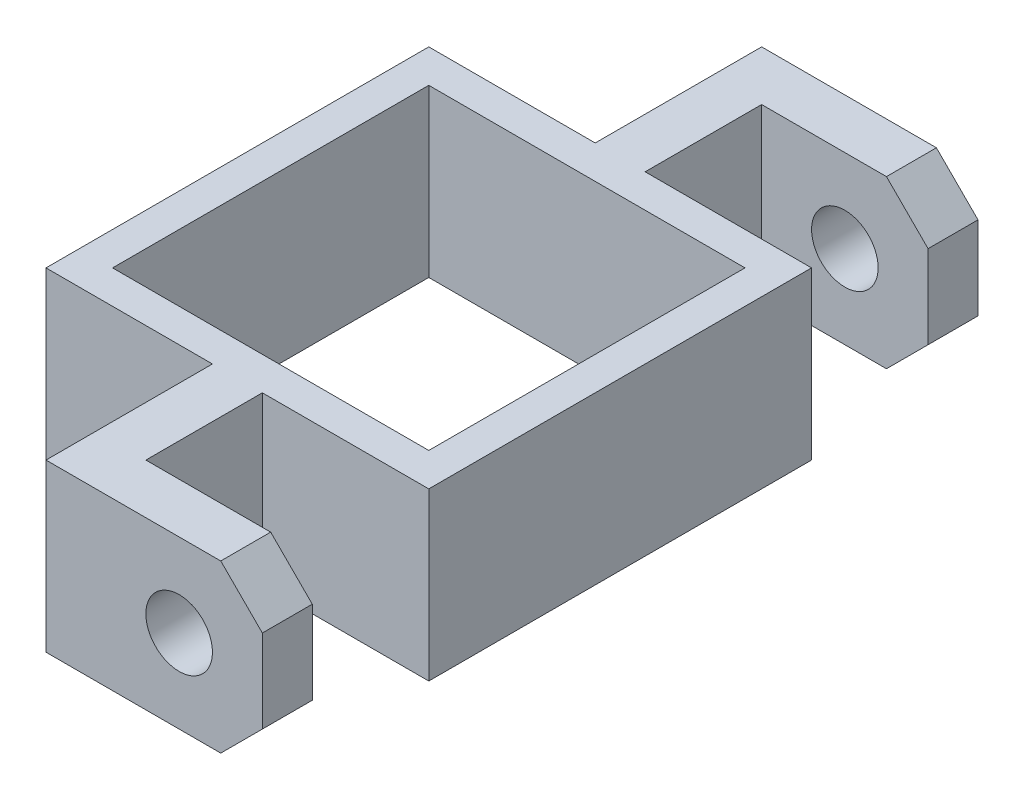
from build123d import *

# Parameters (mm, degrees)
CROQUIS1_W              = 23
CROQUIS1_H              = 23
CROQUIS1_W_2            = 19
CROQUIS1_H_2            = 19
SALIENTE_EXTRUIR1_DEPTH = 10
CROQUIS2_W              = 7
CROQUIS2_H              = 10
SALIENTE_EXTRUIR2_DEPTH = 1.5
SALIENTE_EXTRUIR3_DEPTH = 3
CROQUIS4_R              = 2
CORTAR_EXTRUIR1_DEPTH   = 4


with BuildPart() as part:
    # Croquis1 → Saliente-Extruir1 (new body)
    with BuildSketch(Plane(origin=(0, 0, 0), x_dir=(1, 0, 0), z_dir=(0, 1, 0))):
        Rectangle(CROQUIS1_W, CROQUIS1_H)
        Rectangle(CROQUIS1_W_2, CROQUIS1_H_2, mode=Mode.SUBTRACT)
    extrude(amount=SALIENTE_EXTRUIR1_DEPTH)

    # Croquis2 → Saliente-Extruir2 (add, symmetric)
    with BuildSketch(Plane(origin=(0, 0, 0), x_dir=(0, 0, -1), z_dir=(1, 0, 0))):
        with Locations((15, 5)):
            Rectangle(CROQUIS2_W, CROQUIS2_H)
    saliente_extruir2 = extrude(amount=SALIENTE_EXTRUIR2_DEPTH, both=True)

    # Croquis3 → Saliente-Extruir3 (add)
    with BuildSketch(Plane(origin=(0, 0, -18.5), x_dir=(-1, 0, 0), z_dir=(0, 0, -1))):
        Polygon((-9, 10), (-11.5, 7.5), (-11.5, 2.5), (-9, 0), (1.5, 0), (1.5, 10), align=None)
    saliente_extruir3 = extrude(amount=SALIENTE_EXTRUIR3_DEPTH)

    # Croquis4 → Cortar-Extruir1 (cut)
    with BuildSketch(Plane(origin=(0, 0, -21.5), x_dir=(-1, 0, 0), z_dir=(0, 0, -1))):
        with Locations((-6.5, 5)):
            Circle(CROQUIS4_R)
    cortar_extruir1 = extrude(amount=-CORTAR_EXTRUIR1_DEPTH, mode=Mode.SUBTRACT)

    # Simetría1: Saliente-Extruir2, Saliente-Extruir3, Cortar-Extruir1 across plane
    add(saliente_extruir2.mirror(Plane.XY))
    add(saliente_extruir3.mirror(Plane.XY))
    add(cortar_extruir1.mirror(Plane.XY), mode=Mode.SUBTRACT)


solid = part.part
